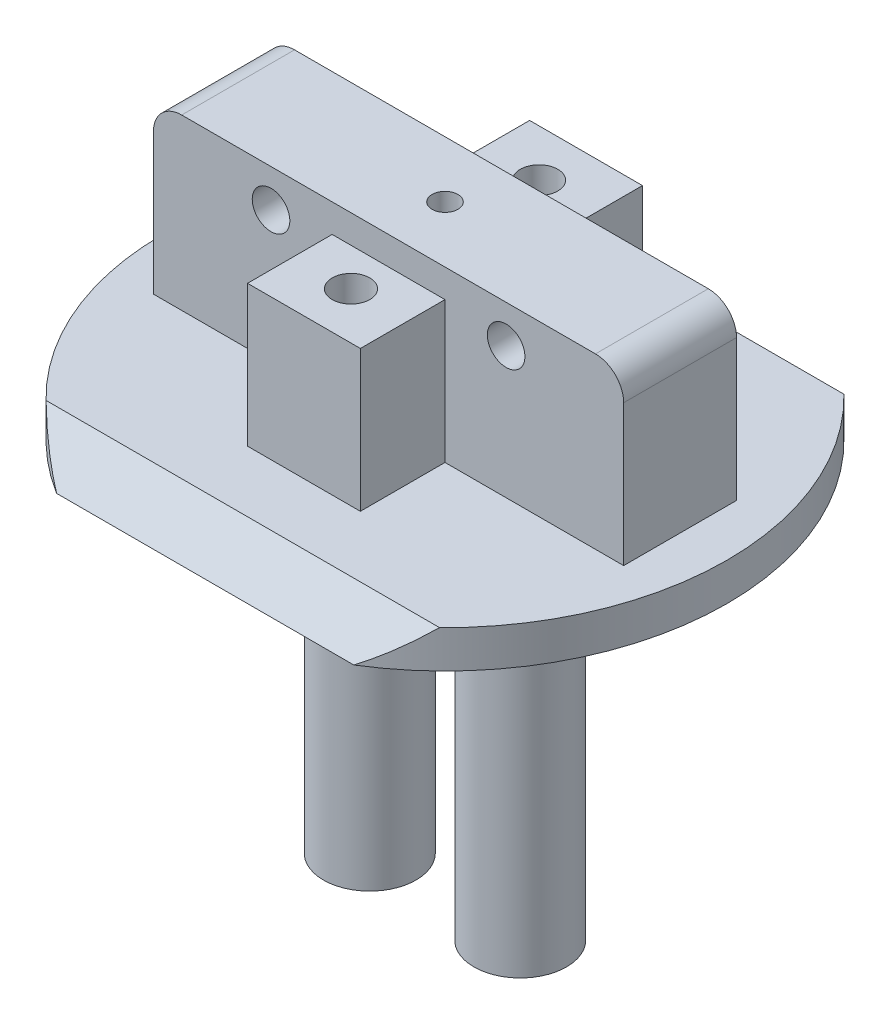
from build123d import *
from build123d.topology import SkipClean

# Parameters (mm, degrees)
SKETCH1_R                            = 30
BOSS_EXTRUDE1_DEPTH                  = 4
BOSS_EXTRUDE2_REACH                  = 44.615
BOSS_EXTRUDE2_END_RADIUS             = 30
BOSS_EXTRUDE2_DIRECTION_2_REACH      = 44.615
BOSS_EXTRUDE2_DIRECTION_2_END_RADIUS = 30
SKETCH3_OUTSIDE_W                    = 78.092
SKETCH3_OUTSIDE_H                    = 69.092
SKETCH3_OUTSIDE_R                    = 21.5
CUT_EXTRUDE2_DEPTH                   = 12.5
BOSS_EXTRUDE3_DEPTH                  = 18
BOSS_EXTRUDE4_DEPTH                  = 15
BOSS_EXTRUDE5_DEPTH                  = 15
CUT_EXTRUDE3_DEPTH                   = 44.292609069
CUT_EXTRUDE3_DEPTH_BACK              = 44.292609069
SKETCH8_R                            = 2
CUT_EXTRUDE8_DEPTH                   = 48.077064479
CUT_EXTRUDE8_DEPTH_BACK              = 48.077064479
CUT_EXTRUDE9_DEPTH                   = 59.659818207
CUT_EXTRUDE11_DEPTH                  = 20
CUT_EXTRUDE12_DEPTH                  = 20
CUT_EXTRUDE13_DEPTH                  = 20
CUT_EXTRUDE14_DEPTH                  = 44.292609069
CUT_EXTRUDE14_DEPTH_BACK             = 44.292609069
SKETCH25_W                           = 66.075437062
SKETCH25_H                           = 20.142243048
SKETCH27_R                           = 1.375
CUT_EXTRUDE16_DEPTH                  = 30
SKETCH28_R                           = 5
CUT_EXTRUDE17_DEPTH                  = 3
CUT_EXTRUDE18_DEPTH                  = 43.690748412
CUT_EXTRUDE18_DEPTH_BACK             = 43.690748412
SKETCH29_W                           = 43.412566799
SKETCH29_H                           = 13.326200919
SKETCH32_W                           = 50
SKETCH32_H                           = 12
BOSS_EXTRUDE6_DEPTH                  = 18
SKETCH35_W                           = 12
SKETCH35_H                           = 15
BOSS_EXTRUDE7_DEPTH                  = 9
CUT_EXTRUDE19_DEPTH                  = 49.746794766
CUT_EXTRUDE19_DEPTH_BACK             = 49.746794766
SKETCH37_R                           = 2
SKETCH36_R                           = 2
CUT_EXTRUDE20_DEPTH                  = 15
SKETCH39_W                           = 12
SKETCH39_H                           = 15
BOSS_EXTRUDE8_DEPTH                  = 9
SKETCH40_R                           = 2
CUT_EXTRUDE21_DEPTH                  = 15
FILLET1_R                            = 3
FILLET2_R                            = 3
CUT_EXTRUDE24_START                  = -20
SKETCH44_R                           = 1.375
CUT_EXTRUDE24_DEPTH                  = 20
SKETCH45_R                           = 4.925
BOSS_EXTRUDE9_DEPTH                  = 42
SKETCH46_R                           = 1.8923
CUT_EXTRUDE25_DEPTH                  = 25.4
SKETCH47_R                           = 1.8923
CUT_EXTRUDE26_DEPTH                  = 25.4


with BuildPart() as part:
    # Sketch1 → Boss-Extrude1 (new body)
    with BuildSketch(Plane(origin=(0, 0, 0), x_dir=(1, 0, 0), z_dir=(0, 1, 0))):
        with Locations(Location((0, 0, 0), (0, 0, 270))):
            Circle(SKETCH1_R)
    extrude(amount=BOSS_EXTRUDE1_DEPTH)

    # Boss-Extrude2: up to this cylinder (the profile starts inside it)
    with SkipClean():  # the faces are left unmerged after this step: merging them gives an invalid solid
        boss_extrude2_end = Plane(origin=(0, 9.396175, 0), z_dir=(0, -1, 0)) * Cylinder(BOSS_EXTRUDE2_END_RADIUS, 150.23, mode=Mode.PRIVATE)
        # Sketch2 → Boss-Extrude2 (add, up to the surface)
        with BuildSketch(Plane(origin=(0, 0, 0), x_dir=(0, 0, -1), z_dir=(1, 0, 0)), mode=Mode.PRIVATE) as boss_extrude2_sk1:
            Polygon((0, 4), (21.5, 4), (9, 16.5), (-9, 16.5), (-21.5, 4), align=None)
        boss_extrude2_tool1 = extrude(boss_extrude2_sk1.sketch, amount=BOSS_EXTRUDE2_REACH, mode=Mode.PRIVATE) & boss_extrude2_end
        add(boss_extrude2_tool1.solids().sort_by_distance((0, 9.396175, 0))[0])

    # Boss-Extrude2 direction 2: up to this cylinder (the profile starts inside it)
    with SkipClean():  # the faces are left unmerged after this step: merging them gives an invalid solid
        boss_extrude2_direction_2_end = Plane(origin=(0, 9.396175, 0), z_dir=(0, -1, 0)) * Cylinder(BOSS_EXTRUDE2_DIRECTION_2_END_RADIUS, 150.23, mode=Mode.PRIVATE)
        # Sketch2 → Boss-Extrude2 direction 2 (add, up to the surface)
        with BuildSketch(Plane(origin=(0, 0, 0), x_dir=(0, 0, -1), z_dir=(1, 0, 0)), mode=Mode.PRIVATE) as boss_extrude2_direction_2_sk1:
            Polygon((0, 4), (21.5, 4), (9, 16.5), (-9, 16.5), (-21.5, 4), align=None)
        boss_extrude2_direction_2_tool1 = extrude(boss_extrude2_direction_2_sk1.sketch, amount=-BOSS_EXTRUDE2_DIRECTION_2_REACH, mode=Mode.PRIVATE) & boss_extrude2_direction_2_end
        add(boss_extrude2_direction_2_tool1.solids().sort_by_distance((0, 9.396175, 0))[0])

    # SurfaceCut1
    split(bisect_by=Plane(origin=(0, 12.75, -12.75), x_dir=(1, 0, 0), z_dir=(0, 0.7071067811865558, -0.7071067811865392)), keep=Keep.BOTTOM)

    # SurfaceCut2
    split(bisect_by=Plane(origin=(0, 12.75, 12.75), x_dir=(1, 0, 0), z_dir=(0, 0.7071067811865509, 0.7071067811865442)), keep=Keep.BOTTOM)

    # Sketch3 outside → Cut-Extrude2 (cut)
    with BuildSketch(Plane(origin=(0, 4, 0), x_dir=(1, 0, 0), z_dir=(0, 1, 0))):
        Rectangle(SKETCH3_OUTSIDE_W, SKETCH3_OUTSIDE_H)
        Circle(SKETCH3_OUTSIDE_R, mode=Mode.SUBTRACT)
    extrude(amount=CUT_EXTRUDE2_DEPTH, mode=Mode.SUBTRACT)

    # Sketch5 → Boss-Extrude3 (add)
    with BuildSketch(Plane(origin=(0, 0, 0), x_dir=(-1, 0, 0), z_dir=(0, -1, 0))):
        Polygon((0, -6), (-17.5, -6), (-17.5, 6), (17.5, 6), (17.5, -6), align=None)
    extrude(amount=BOSS_EXTRUDE3_DEPTH)

    # Sketch6 → Boss-Extrude4 (add)
    with BuildSketch(Plane.XZ):
        Polygon((0, 15), (7, 15), (7, 6), (-7, 6), (-7, 15), align=None)
    extrude(amount=BOSS_EXTRUDE4_DEPTH)

    # Sketch7 → Boss-Extrude5 (add)
    with BuildSketch(Plane.XZ):
        Polygon((0, -15), (7, -15), (7, -6), (-7, -6), (-7, -15), align=None)
    extrude(amount=BOSS_EXTRUDE5_DEPTH)

    # Sketch8 → Cut-Extrude3 (cut, two sides: drawn at the far end of the back side and taken through both)
    with BuildSketch(Plane.XY.offset(-CUT_EXTRUDE3_DEPTH_BACK)):
        with Locations((-12.5, -12.5)):
            Circle(SKETCH8_R)
        with Locations((12.5, -12.5)):
            Circle(SKETCH8_R)
    extrude(amount=CUT_EXTRUDE3_DEPTH + CUT_EXTRUDE3_DEPTH_BACK, mode=Mode.SUBTRACT)

    # Sketch16 → Cut-Extrude8 (cut, two sides: drawn at the far end of the back side and taken through both)
    with BuildSketch(Plane.XY.offset(6).offset(-CUT_EXTRUDE8_DEPTH_BACK)):
        Polygon((17.5, -18), (17.5, -14.5), (14, -18), align=None)
        Polygon((-17.5, -18), (-14, -18), (-17.5, -14.5), align=None)
    extrude(amount=CUT_EXTRUDE8_DEPTH + CUT_EXTRUDE8_DEPTH_BACK, mode=Mode.SUBTRACT)

    # Sketch17 → Cut-Extrude9 (cut, through all)
    with BuildSketch(Plane(origin=(10.365975269, -9.674910251, -8.062425209), x_dir=(-0.3613483622370374, 0.337258471421235, -0.8693009171531012), z_dir=(0.6355070151731325, -0.5931398808282571, -0.49428323402354774))):
        Polygon((-2.372510104, -6.189601271), (7.980636686, -0.706686759), (7.980636686, -10.965829024), align=None)
    extrude(amount=CUT_EXTRUDE9_DEPTH, mode=Mode.SUBTRACT)

    # Sketch19 → Cut-Extrude11 (cut)
    with BuildSketch(Plane(origin=(-10.365975269, -9.674910251, -8.062425209), x_dir=(0.3613483622370374, 0.33725847142123494, -0.8693009171531012), z_dir=(0.6355070151731324, 0.5931398808282571, 0.4942832340235476))):
        Polygon((-2.372510104, -6.189601271), (7.980636686, -10.965829024), (7.980636686, -0.706686759), align=None)
    extrude(amount=-CUT_EXTRUDE11_DEPTH, mode=Mode.SUBTRACT)

    # Sketch20 → Cut-Extrude12 (cut)
    with BuildSketch(Plane(origin=(-10.365975269, -9.674910251, 8.062425209), x_dir=(-0.3613483622370374, -0.3372584714212349, -0.8693009171531013), z_dir=(0.6355070151731326, 0.593139880828257, -0.49428323402354757))):
        Polygon((2.372510104, -6.189601271), (-7.980636686, -0.706686759), (-7.980636686, -10.965829024), align=None)
    extrude(amount=-CUT_EXTRUDE12_DEPTH, mode=Mode.SUBTRACT)

    # Sketch21 → Cut-Extrude13 (cut)
    with BuildSketch(Plane(origin=(10.365975269, -9.674910251, 8.062425209), x_dir=(-0.3613483622370374, 0.3372584714212349, 0.8693009171531013), z_dir=(-0.6355070151731326, 0.593139880828257, -0.49428323402354757))):
        Polygon((-2.372510104, -6.189601271), (7.980636686, -0.706686759), (7.980636686, -10.965829024), align=None)
    extrude(amount=-CUT_EXTRUDE13_DEPTH, mode=Mode.SUBTRACT)

    # Sketch25 → Cut-Extrude14 (cut, two sides: drawn at the far end of the back side and taken through both)
    with BuildSketch(Plane.XY.offset(-CUT_EXTRUDE14_DEPTH_BACK)):
        with Locations((0, -10.071121524)):
            Rectangle(SKETCH25_W, SKETCH25_H)
    extrude(amount=CUT_EXTRUDE14_DEPTH + CUT_EXTRUDE14_DEPTH_BACK, mode=Mode.SUBTRACT)

    # Sketch27 → Cut-Extrude16 (cut)
    with BuildSketch(Plane(origin=(0, 16.5, 0), x_dir=(1, 0, 0), z_dir=(0, 1, 0))):
        with Locations(Location((0, 0, 0), (0, 0, 270))):
            Circle(SKETCH27_R)
    extrude(amount=-CUT_EXTRUDE16_DEPTH, mode=Mode.SUBTRACT)

    # Sketch28 → Cut-Extrude17 (cut)
    with BuildSketch(Plane.XZ):
        with Locations(Location((0, -15, 0), (0, 0, 270))):
            Circle(SKETCH28_R)
        with Locations(Location((22, 0, 0), (0, 0, 270))):
            Circle(SKETCH28_R)
        with Locations(Location((0, 15, 0), (0, 0, 270))):
            Circle(SKETCH28_R)
        with Locations(Location((-22, 0, 0), (0, 0, 270))):
            Circle(SKETCH28_R)
        with Locations(Location((-14, 12, 0), (0, 0, 270))):
            Circle(SKETCH28_R)
        with Locations(Location((14, 12, 0), (0, 0, 270))):
            Circle(SKETCH28_R)
        with Locations(Location((14, -12, 0), (0, 0, 270))):
            Circle(SKETCH28_R)
        with Locations(Location((-14, -12, 0), (0, 0, 270))):
            Circle(SKETCH28_R)
    extrude(amount=-CUT_EXTRUDE17_DEPTH, mode=Mode.SUBTRACT)

    # Sketch29 → Cut-Extrude18 (cut, two sides: drawn at the far end of the back side and taken through both)
    with BuildSketch(Plane(origin=(0, 0, 0), x_dir=(0, 0, -1), z_dir=(1, 0, 0)).offset(-CUT_EXTRUDE18_DEPTH_BACK)):
        with Locations((0.2062834, 10.66310046)):
            Rectangle(SKETCH29_W, SKETCH29_H)
    extrude(amount=CUT_EXTRUDE18_DEPTH + CUT_EXTRUDE18_DEPTH_BACK, mode=Mode.SUBTRACT)

    # Sketch32 → Boss-Extrude6 (add)
    with BuildSketch(Plane(origin=(0, 4, 0), x_dir=(1, 0, 0), z_dir=(0, 1, 0))):
        Rectangle(SKETCH32_W, SKETCH32_H)
    extrude(amount=BOSS_EXTRUDE6_DEPTH)

    # Sketch35 → Boss-Extrude7 (add)
    with BuildSketch(Plane(origin=(0, 0, -6), x_dir=(-1, 0, 0), z_dir=(0, 0, -1))):
        with Locations((0, 11.5)):
            Rectangle(SKETCH35_W, SKETCH35_H)
    extrude(amount=BOSS_EXTRUDE7_DEPTH)

    # Sketch37 → Cut-Extrude19 (cut, two sides: drawn at the far end of the back side and taken through both)
    with BuildSketch(Plane(origin=(0, 0, -6), x_dir=(-1, 0, 0), z_dir=(0, 0, -1)).offset(-CUT_EXTRUDE19_DEPTH_BACK)):
        with Locations((-12.5, 18)):
            Circle(SKETCH37_R)
        with Locations((12.5, 18)):
            Circle(SKETCH37_R)
    extrude(amount=CUT_EXTRUDE19_DEPTH + CUT_EXTRUDE19_DEPTH_BACK, mode=Mode.SUBTRACT)

    # Sketch36 → Cut-Extrude20 (cut)
    with BuildSketch(Plane(origin=(0, 19, 0), x_dir=(1, 0, 0), z_dir=(0, 1, 0))):
        with Locations(Location((0, 10, 0), (0, 0, 270))):
            Circle(SKETCH36_R)
    extrude(amount=-CUT_EXTRUDE20_DEPTH, mode=Mode.SUBTRACT)

    # Sketch39 → Boss-Extrude8 (add)
    with BuildSketch(Plane.XY.offset(6)):
        with Locations((0, 11.5)):
            Rectangle(SKETCH39_W, SKETCH39_H)
    extrude(amount=BOSS_EXTRUDE8_DEPTH)

    # Sketch40 → Cut-Extrude21 (cut)
    with BuildSketch(Plane(origin=(0, 19, 0), x_dir=(1, 0, 0), z_dir=(0, 1, 0))):
        with Locations(Location((0, -10, 0), (0, 0, 270))):
            Circle(SKETCH40_R)
    extrude(amount=-CUT_EXTRUDE21_DEPTH, mode=Mode.SUBTRACT)

    # Fillet1
    fillet1_edges = [part.edges().sort_by_distance(p)[0] for p in [
        (25, 22, 0),
    ]]
    fillet(fillet1_edges, radius=FILLET1_R)

    # Fillet2
    fillet2_edges = [part.edges().sort_by_distance(p)[0] for p in [
        (-25, 22, 0),
    ]]
    fillet(fillet2_edges, radius=FILLET2_R)

    # Sketch44 → Cut-Extrude24 (cut)
    with BuildSketch(Plane.XZ.offset(-4).offset(CUT_EXTRUDE24_START)):
        with Locations(Location((0, 0, 0), (0, 0, 90))):
            Circle(SKETCH44_R)
    extrude(amount=CUT_EXTRUDE24_DEPTH, mode=Mode.SUBTRACT)

    # Sketch45 → Boss-Extrude9 (add)
    with BuildSketch(Plane.XZ):
        with Locations(Location((-8, 0, 0), (0, 0, 90))):
            Circle(SKETCH45_R)
        with Locations(Location((8, 0, 0), (0, 0, 90))):
            Circle(SKETCH45_R)
    extrude(amount=BOSS_EXTRUDE9_DEPTH)

    # Sketch46 → Cut-Extrude25 (cut)
    with BuildSketch(Plane.XZ.offset(42)):
        with Locations(Location((-8, 0, 0), (0, 0, 270))):
            Circle(SKETCH46_R)
    extrude(amount=-CUT_EXTRUDE25_DEPTH, mode=Mode.SUBTRACT)

    # Sketch47 → Cut-Extrude26 (cut)
    with BuildSketch(Plane.XZ.offset(42)):
        with Locations(Location((8, 0, 0), (0, 0, 270))):
            Circle(SKETCH47_R)
    extrude(amount=-CUT_EXTRUDE26_DEPTH, mode=Mode.SUBTRACT)


solid = part.part
